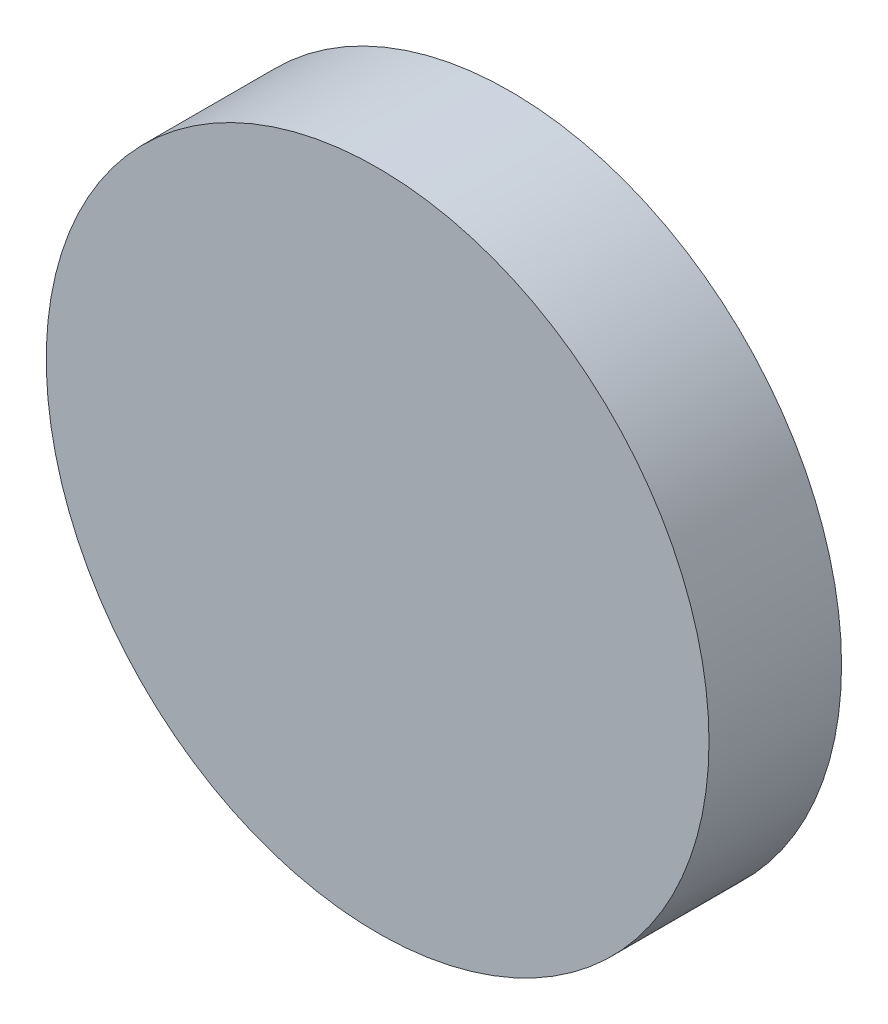
from build123d import *

# Parameters (mm, degrees)
STORE_SOG1_KONDENSER_FAN_START = -200
SKETCH1_R                      = 100
STORE_SOG1_KONDENSER_FAN_DEPTH = 40


with BuildPart() as part:
    # Sketch1 → STORE_sog1_kondenser_fan (new body)
    with BuildSketch(Plane.XY.offset(STORE_SOG1_KONDENSER_FAN_START)):
        with Locations((450, 1805)):
            Circle(SKETCH1_R)
    extrude(amount=-STORE_SOG1_KONDENSER_FAN_DEPTH)


solid = part.part
